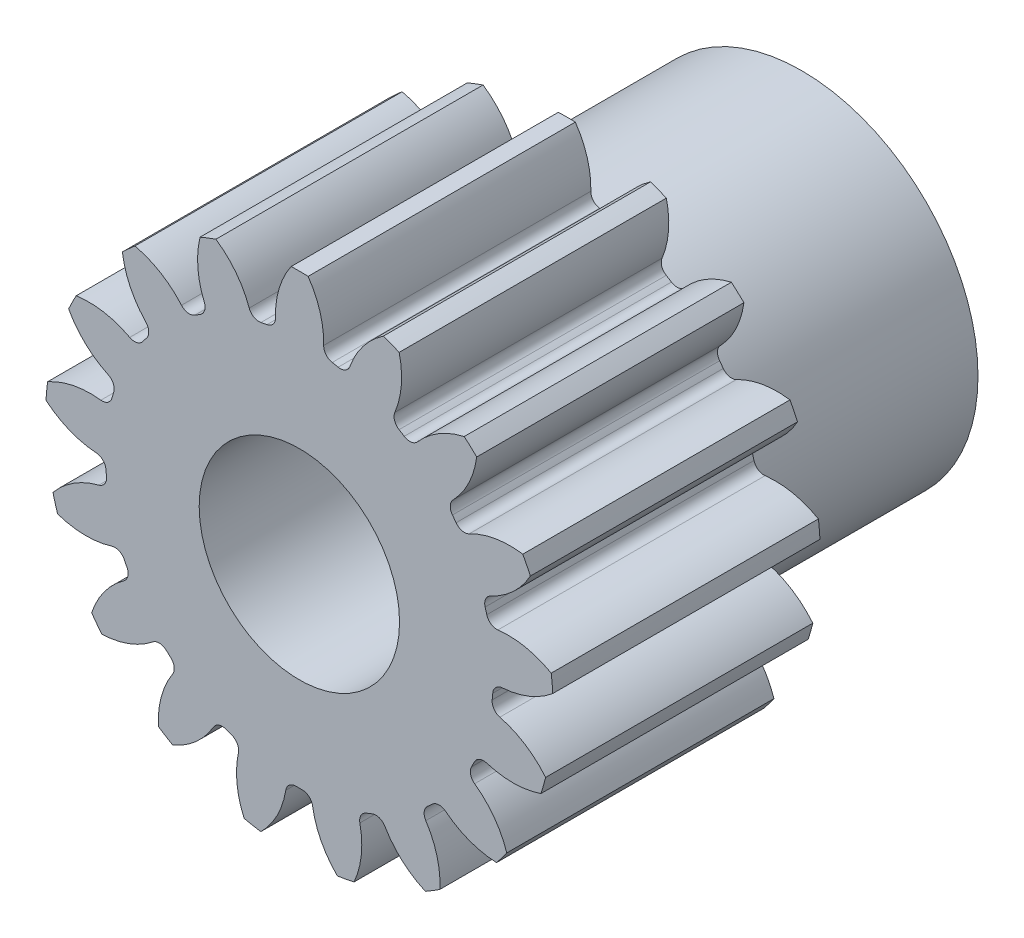
from build123d import *

# Parameters (mm, degrees)
SKETCH3_R         = 12.065
GEARBODY_DEPTH    = 12.7
TOOTHCUT_DEPTH    = 22.270130465
CIRPATTERN1_COUNT = 17
HUB1DIA_R         = 8.382000333
HUB1_DEPTH        = 11.175999939
BOREDIA_R         = 4.7625
BORE_DEPTH        = 12700


with BuildPart() as part:
    # Sketch3 → gearBody (new body)
    with BuildSketch(Plane.XY):
        Circle(SKETCH3_R)
    extrude(amount=GEARBODY_DEPTH)

    # Sketch2 → toothCut (cut, through all)
    with BuildSketch(Plane.XY):
        with BuildLine():
            ThreePointArc((9.165327575, -1.00441948), (9.179937747, -0.860715402), (9.192294908, -0.71680008))
            ThreePointArc((9.192294908, -0.71680008), (9.336182685, -0.406710497), (9.647887968, -0.266357162))
            ThreePointArc((9.647887968, -0.266357162), (11.435171232, 0.272625956), (12.806443829, 1.539312867))
            ThreePointArc((12.806443829, 1.539312867), (12.842298492, -1.204100116), (12.29710439, -3.893033686))
            ThreePointArc((12.29710439, -3.893033686), (11.185191898, -2.39352214), (9.529248769, -1.531700451))
            ThreePointArc((9.529248769, -1.531700451), (9.249065984, -1.335851405), (9.165327575, -1.00441948))
        make_face()
    toothcut = extrude(amount=TOOTHCUT_DEPTH, mode=Mode.SUBTRACT)

    # CirPattern1: toothCut ×17 about axis
    cirpattern1_axis = Axis((0, 0, 0), (0, 0, 1))
    for i in range(1, CIRPATTERN1_COUNT):
        add(toothcut.rotate(cirpattern1_axis, i * 360 / CIRPATTERN1_COUNT), mode=Mode.SUBTRACT)

    # hub1Dia → hub1 (add)
    with BuildSketch(Plane(origin=(0, 0, 0), x_dir=(-1, 0, 0), z_dir=(0, 0, -1))):
        with Locations(Location((0, 0, 0), (0, 0, 180))):
            Circle(HUB1DIA_R)
    extrude(amount=HUB1_DEPTH)

    # boreDia → bore (cut, symmetric)
    with BuildSketch(Plane.XY):
        Circle(BOREDIA_R)
    extrude(amount=BORE_DEPTH, both=True, mode=Mode.SUBTRACT)


solid = part.part
